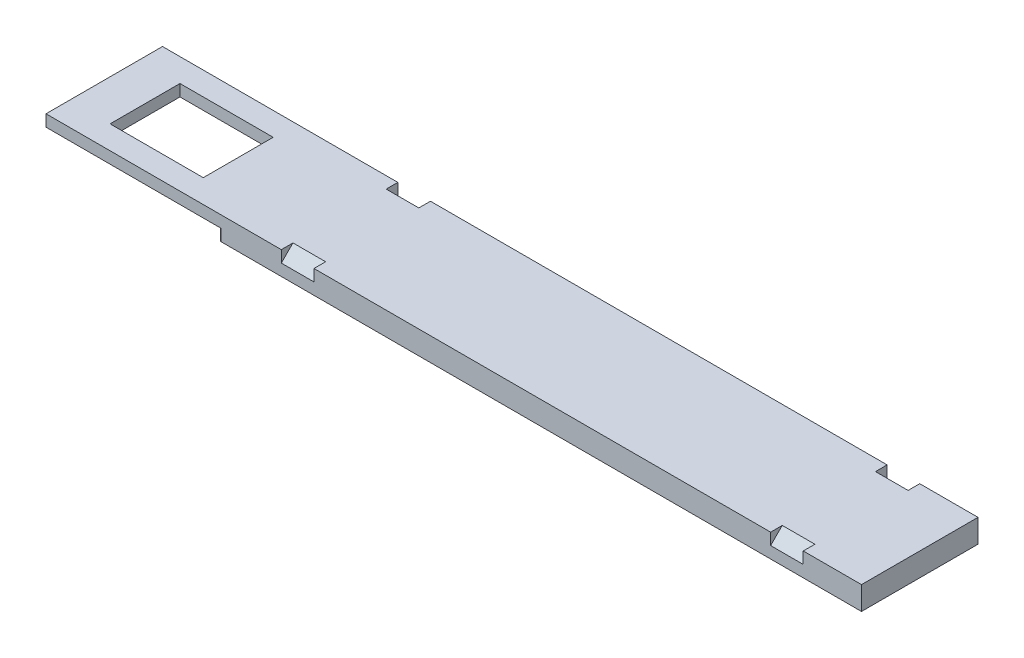
from build123d import *

# Parameters (mm, degrees)
SKETCH1_W           = 70
SKETCH1_H           = 10
BOSS_EXTRUDE1_DEPTH = 2
CUT_EXTRUDE1_START  = -5
CUT_EXTRUDE1_DEPTH  = 2.8
CUT_EXTRUDE2_START  = -47
CUT_EXTRUDE2_DEPTH  = 2.8
SKETCH3_W           = 15
SKETCH3_H           = 10
CUT_EXTRUDE3_DEPTH  = 1
SKETCH4_W           = 8
SKETCH4_H           = 6
CUT_EXTRUDE4_DEPTH  = 36.369478368


with BuildPart() as part:
    # Sketch1 → Boss-Extrude1 (new body)
    with BuildSketch(Plane(origin=(0, 0, 0), x_dir=(1, 0, 0), z_dir=(0, 1, 0))):
        Rectangle(SKETCH1_W, SKETCH1_H)
    extrude(amount=BOSS_EXTRUDE1_DEPTH)

    # Sketch2 → Cut-Extrude1 (cut)
    with BuildSketch(Plane(origin=(35, 0, 0), x_dir=(0, 0, -1), z_dir=(1, 0, 0)).offset(CUT_EXTRUDE1_START)):
        Polygon((-5, 2), (-5, 1), (-4, 2), align=None)
        Polygon((5, 2), (5, 1), (4, 2), align=None)
    extrude(amount=-CUT_EXTRUDE1_DEPTH, mode=Mode.SUBTRACT)

    # Sketch2<2> → Cut-Extrude2 (cut)
    with BuildSketch(Plane(origin=(35, 0, 0), x_dir=(0, 0, -1), z_dir=(1, 0, 0)).offset(CUT_EXTRUDE2_START)):
        Polygon((-5, 2), (-5, 1), (-4, 2), align=None)
        Polygon((5, 2), (5, 1), (4, 2), align=None)
    extrude(amount=-CUT_EXTRUDE2_DEPTH, mode=Mode.SUBTRACT)

    # Sketch3 → Cut-Extrude3 (cut)
    with BuildSketch(Plane.XZ):
        with Locations((-27.5, 0)):
            Rectangle(SKETCH3_W, SKETCH3_H)
    extrude(amount=-CUT_EXTRUDE3_DEPTH, mode=Mode.SUBTRACT)

    # Sketch4 → Cut-Extrude4 (cut, through all)
    with BuildSketch(Plane.XZ.offset(-1)):
        with Locations((-27.5, 0)):
            Rectangle(SKETCH4_W, SKETCH4_H)
    extrude(amount=-CUT_EXTRUDE4_DEPTH, mode=Mode.SUBTRACT)


solid = part.part
